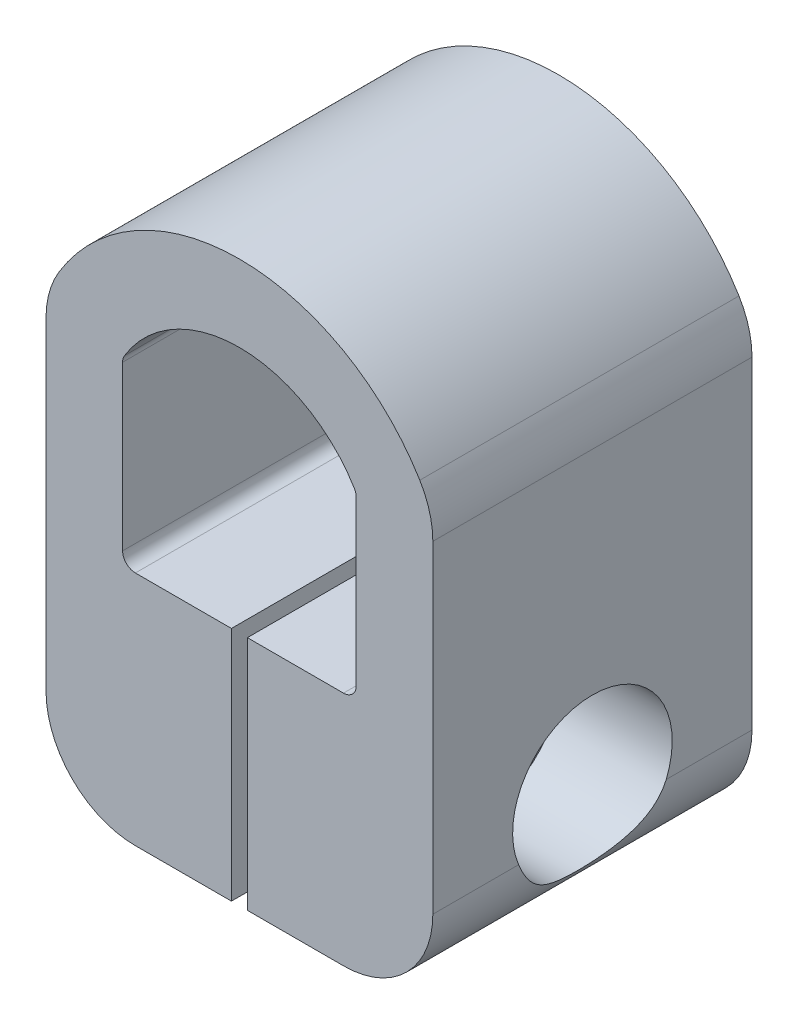
from build123d import *

# Parameters (mm, degrees)
BOSS_EXTRUDE1_DEPTH = 25.4
SKETCH2_R           = 6.35
CUT_EXTRUDE1_DEPTH  = 8.89
SKETCH3_R           = 3.175
CUT_EXTRUDE2_DEPTH  = 6.35
SKETCH4_W           = 0.635
SKETCH4_H           = 18.796
CUT_EXTRUDE3_DEPTH  = 40.162657148
SKETCH5_R           = 1.905
CUT_EXTRUDE4_DEPTH  = 40.416561089


with BuildPart() as part:
    # Sketch1 → Boss-Extrude1 (new body)
    with BuildSketch(Plane.XY):
        with BuildLine():
            ThreePointArc((-14.355971037, 17.457748951), (-15.128392597, 15.680502137), (-15.3924, 13.760725746))
            Line((-15.3924, 13.760725746), (-15.3924, 0.762))
            Line((-15.3924, 0.762), (-15.3924, -11.938))
            ThreePointArc((-15.3924, -11.938), (-13.309343428, -16.966943428), (-8.2804, -19.05))
            Line((-8.2804, -19.05), (8.2804, -19.05))
            ThreePointArc((8.2804, -19.05), (13.309343428, -16.966943428), (15.3924, -11.938))
            Line((15.3924, -11.938), (15.3924, 0.762))
            Line((15.3924, 0.762), (15.3924, 13.760725746))
            ThreePointArc((15.3924, 13.760725746), (15.128392597, 15.680502137), (14.355971037, 17.457748951))
            ThreePointArc((14.355971037, 17.457748951), (0, 25.527), (-14.355971037, 17.457748951))
        make_face()
        with BuildLine():
            Line((-9.2964, 0.762), (-9.2964, 13.760725746))
            ThreePointArc((-9.2964, 13.760725746), (-9.258684657, 14.034979516), (-9.14833872, 14.288871918))
            ThreePointArc((-9.14833872, 14.288871918), (0, 19.431), (9.14833872, 14.288871918))
            ThreePointArc((9.14833872, 14.288871918), (9.258684657, 14.034979516), (9.2964, 13.760725746))
            Line((9.2964, 13.760725746), (9.2964, 0.762))
            ThreePointArc((9.2964, 0.762), (8.99882049, 0.04357951), (8.2804, -0.254))
            Line((8.2804, -0.254), (-8.2804, -0.254))
            ThreePointArc((-8.2804, -0.254), (-8.99882049, 0.04357951), (-9.2964, 0.762))
        make_face(mode=Mode.SUBTRACT)
    extrude(amount=BOSS_EXTRUDE1_DEPTH)

    # Sketch2 → Cut-Extrude1 (cut)
    with BuildSketch(Plane(origin=(15.3924, 0, 0), x_dir=(0, 0, -1), z_dir=(1, 0, 0))):
        with Locations(Location((-12.7, -9.525, 0), (0, 0, 90))):
            Circle(SKETCH2_R)
    extrude(amount=-CUT_EXTRUDE1_DEPTH, mode=Mode.SUBTRACT)

    # Sketch3 → Cut-Extrude2 (cut)
    with BuildSketch(Plane(origin=(6.5024, 0, 0), x_dir=(0, 0, -1), z_dir=(1, 0, 0))):
        with Locations(Location((-12.7, -9.525, 0), (0, 0, 90))):
            Circle(SKETCH3_R)
    extrude(amount=-CUT_EXTRUDE2_DEPTH, mode=Mode.SUBTRACT)

    # Sketch4 → Cut-Extrude3 (cut, through all)
    with BuildSketch(Plane.XY.offset(25.4)):
        with Locations((0.3175, -9.652)):
            Rectangle(SKETCH4_W, SKETCH4_H)
        with Locations((-0.3175, -9.652)):
            Rectangle(SKETCH4_W, SKETCH4_H)
    extrude(amount=-CUT_EXTRUDE3_DEPTH, mode=Mode.SUBTRACT)

    # Sketch5 → Cut-Extrude4 (cut, through all)
    with BuildSketch(Plane(origin=(-0.635, 0, 0), x_dir=(0, 0, -1), z_dir=(1, 0, 0))):
        with Locations(Location((-12.7, -9.525, 0), (0, 0, 90))):
            Circle(SKETCH5_R)
    extrude(amount=-CUT_EXTRUDE4_DEPTH, mode=Mode.SUBTRACT)


solid = part.part
